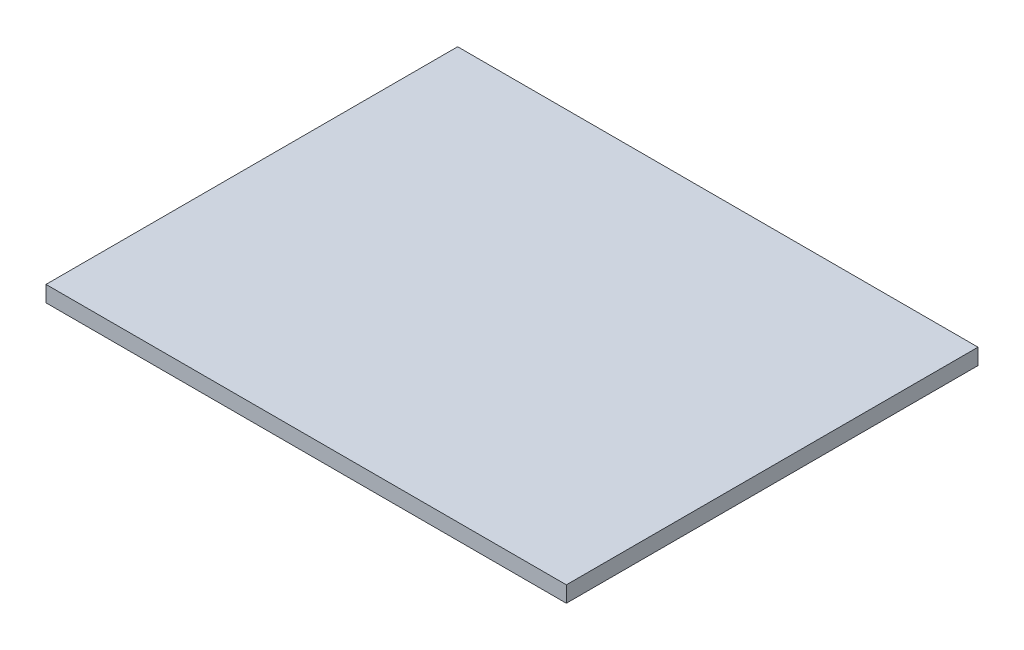
from build123d import *

# Parameters (mm, degrees)
SKETCH1_W           = 65.1
SKETCH1_H           = 51.5
BOSS_EXTRUDE1_DEPTH = 2


with BuildPart() as part:
    # Sketch1 → Boss-Extrude1 (new body)
    with BuildSketch(Plane(origin=(0, 0, 0), x_dir=(1, 0, 0), z_dir=(0, 1, 0))):
        Rectangle(SKETCH1_W, SKETCH1_H)
    extrude(amount=BOSS_EXTRUDE1_DEPTH)


solid = part.part
